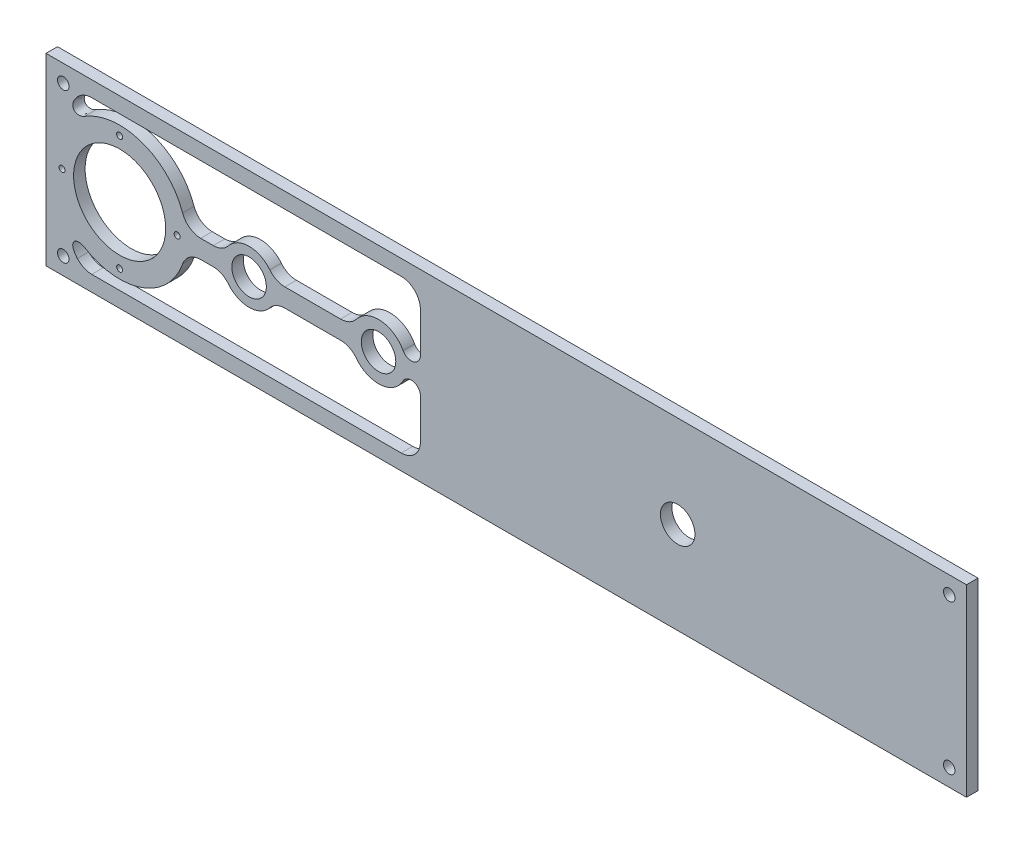
from build123d import *

# Parameters (mm, degrees)
SKETCH1_W           = 508
SKETCH1_H           = 101.6
BOSS_EXTRUDE1_DEPTH = 6.35
SKETCH2_R           = 25.4
SKETCH2_R_2         = 1.651
MOTOR_MOUNT_DEPTH   = 6.35
SKETCH3_R           = 9.525
CUT_EXTRUDE2_DEPTH  = 511.573170564
SKETCH4_R           = 3.175
CUT_EXTRUDE3_DEPTH  = 511.573170564
CUT_EXTRUDE4_DEPTH  = 511.573170564


with BuildPart() as part:
    # Sketch1 → Boss-Extrude1 (new body)
    with BuildSketch(Plane.XY):
        with Locations((254, 0)):
            Rectangle(SKETCH1_W, SKETCH1_H)
    extrude(amount=-BOSS_EXTRUDE1_DEPTH)

    # Sketch2 → Motor mount (cut)
    with BuildSketch(Plane.XY):
        with Locations((40.64, 0)):
            Circle(SKETCH2_R)
        with Locations((72.39, 0)):
            Circle(SKETCH2_R_2)
        with Locations((40.64, -31.75)):
            Circle(SKETCH2_R_2)
        with Locations((8.89, 0)):
            Circle(SKETCH2_R_2)
        with Locations((40.64, 31.75)):
            Circle(SKETCH2_R_2)
    extrude(amount=-MOTOR_MOUNT_DEPTH, mode=Mode.SUBTRACT)

    # Sketch3 → Cut-Extrude2 (cut, through all)
    with BuildSketch(Plane.XY):
        with Locations((112.0775, 0)):
            Circle(SKETCH3_R)
        with Locations((183.515, 0)):
            Circle(SKETCH3_R)
        with Locations((348.615, 0)):
            Circle(SKETCH3_R)
    extrude(amount=-CUT_EXTRUDE2_DEPTH, mode=Mode.SUBTRACT)

    # Sketch4 → Cut-Extrude3 (cut, through all)
    with BuildSketch(Plane.XY):
        with Locations((9.525, 41.275)):
            Circle(SKETCH4_R)
        with Locations((9.525, -41.275)):
            Circle(SKETCH4_R)
        with Locations((498.475, 41.275)):
            Circle(SKETCH4_R)
        with Locations((498.475, -41.275)):
            Circle(SKETCH4_R)
    extrude(amount=-CUT_EXTRUDE3_DEPTH, mode=Mode.SUBTRACT)

    # Sketch7 → Cut-Extrude4 (cut, through all)
    with BuildSketch(Plane.XY):
        with BuildLine():
            Line((85.406292789, 5.08), (92.341412089, 5.08))
            ThreePointArc((92.341412089, 5.08), (96.950572969, 6.134064693), (100.643442411, 9.08671294))
            ThreePointArc((100.643442411, 9.08671294), (112.0775, 14.605), (123.511557589, 9.08671294))
            ThreePointArc((123.511557589, 9.08671294), (127.204427031, 6.134064693), (131.813587911, 5.08))
            Line((131.813587911, 5.08), (162.585112959, 5.08))
            ThreePointArc((162.585112959, 5.08), (167.45975122, 6.214203951), (171.333000793, 9.383818205))
            ThreePointArc((171.333000793, 9.383818205), (184.777760897, 15.325227036), (197.068677539, 7.263261936))
            ThreePointArc((197.068677539, 7.263261936), (202.783248212, 4.735656121), (206.626270766, 9.662753319))
            Line((206.626270766, 9.662753319), (206.626270766, 31.603209647))
            ThreePointArc((206.626270766, 31.603209647), (203.520318205, 39.101642443), (196.02188541, 42.207595003))
            Line((196.02188541, 42.207595003), (25.263102588, 42.207595003))
            ThreePointArc((25.263102588, 42.207595003), (20.881723867, 41.260150637), (17.283250038, 38.587115578))
            add(Edge.make_bspline(
                [(17.283250038, 38.587115578), (11.530533455, 32.014027317), (16.787146308, 28.551640426), (21.263438452, 31.320883809)],
                knots=[0, 0, 0, 0, 1, 1, 1, 1], degree=3))
            ThreePointArc((21.263438452, 31.320883809), (52.918543043, 34.722993545), (75.39838363, 12.177999321))
            ThreePointArc((75.39838363, 12.177999321), (79.271558889, 7.034643814), (85.406292789, 5.08))
        make_face()
    cut_extrude4 = extrude(amount=-CUT_EXTRUDE4_DEPTH, mode=Mode.SUBTRACT)

    # Mirror1: Cut-Extrude4 across plane
    add(cut_extrude4.mirror(Plane.ZX), mode=Mode.SUBTRACT)


solid = part.part
